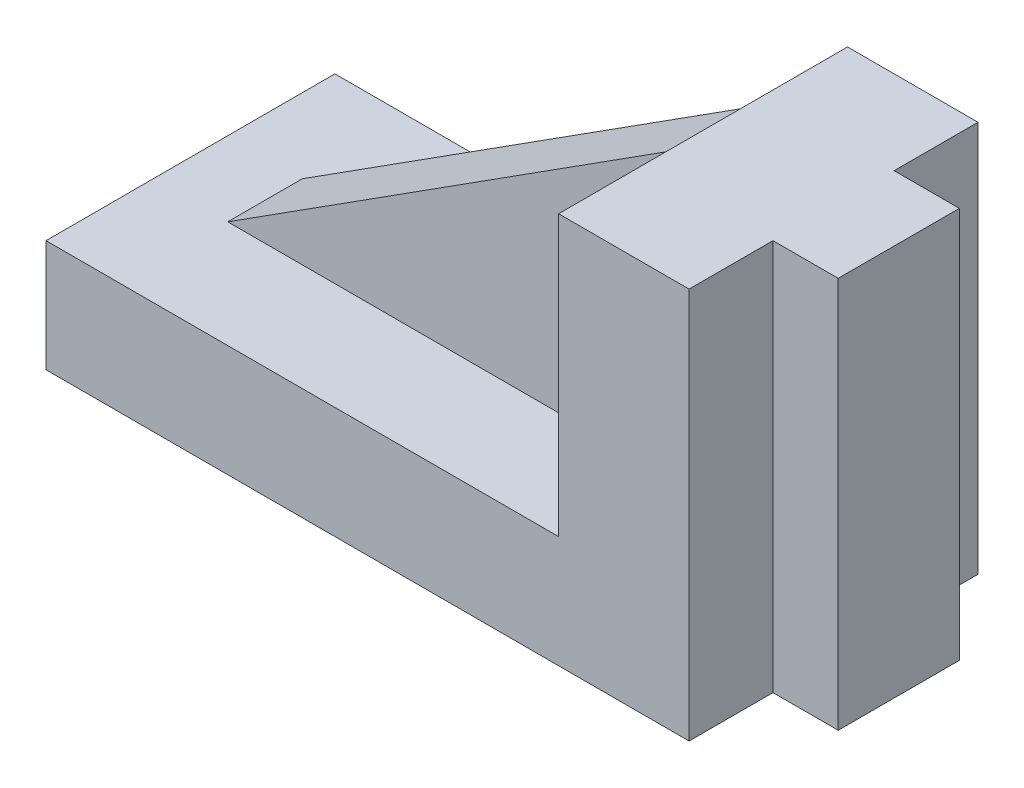
from build123d import *

# Parameters (mm, degrees)
SKETCH1_W               = 76
SKETCH1_H               = 42
BOSS_EXTRUDE1_DEPTH     = 15.5
SKETCH2_W               = 9
SKETCH2_H               = 42
CUT_EXTRUDE1_DEPTH      = 7
CUT_EXTRUDE2_DEPTH      = 93.200867675
CUT_EXTRUDE2_DEPTH_BACK = 93.200867675
SKETCH3_W               = 55
SKETCH3_H               = 30
BOSS_EXTRUDE2_DEPTH     = 4


with BuildPart() as part:
    # Sketch1 → Boss-Extrude1 (new, symmetric)
    with BuildSketch(Plane.XY):
        with Locations((38, 21)):
            Rectangle(SKETCH1_W, SKETCH1_H)
    extrude(amount=BOSS_EXTRUDE1_DEPTH, both=True)

    # Sketch2 → Cut-Extrude1 (cut)
    with BuildSketch(Plane(origin=(76, 0, 0), x_dir=(0, 0, -1), z_dir=(1, 0, 0))):
        with Locations((-11, 21)):
            Rectangle(SKETCH2_W, SKETCH2_H)
        with Locations((11, 21)):
            Rectangle(SKETCH2_W, SKETCH2_H)
    extrude(amount=-CUT_EXTRUDE1_DEPTH, mode=Mode.SUBTRACT)

    # Sketch3 → Cut-Extrude2 (cut, two sides: drawn at the far end of the back side and taken through both)
    with BuildSketch(Plane.XY.offset(15.5).offset(-CUT_EXTRUDE2_DEPTH_BACK)):
        with Locations((27.5, 27)):
            Rectangle(SKETCH3_W, SKETCH3_H)
    extrude(amount=CUT_EXTRUDE2_DEPTH + CUT_EXTRUDE2_DEPTH_BACK, mode=Mode.SUBTRACT)

    # Sketch5 → Boss-Extrude2 (add, symmetric)
    with BuildSketch(Plane.XY):
        Polygon((55, 42), (8, 12), (55, 12), (55, 12.687234068), align=None)
    extrude(amount=BOSS_EXTRUDE2_DEPTH, both=True)


solid = part.part
